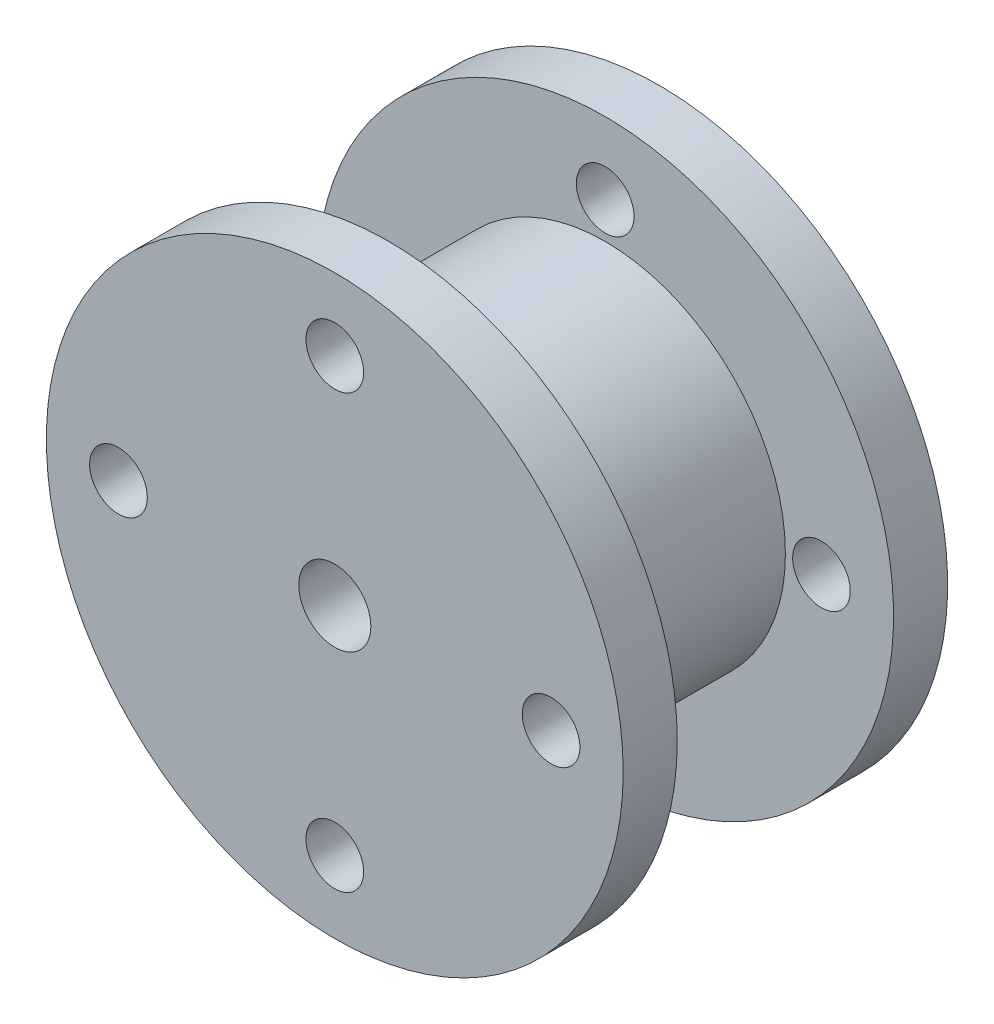
from build123d import *

# Parameters (mm, degrees)
SKETCH1_R               = 5
BOSS_EXTRUDE1_DEPTH     = 6
SKETCH2_R               = 8
BOSS_EXTRUDE2_DEPTH     = 1.5
BOSS_EXTRUDE3_START     = 1.5
SKETCH3_R               = 8
BOSS_EXTRUDE3_DEPTH     = 1.5
CUT_EXTRUDE1_DEPTH      = 15.456832295
CUT_EXTRUDE1_DEPTH_BACK = 15.456832295
SKETCH4_R               = 0.8
CUT_EXTRUDE2_DEPTH      = 15.456832295
CUT_EXTRUDE2_DEPTH_BACK = 15.456832295
SKETCH5_R               = 1


with BuildPart() as part:
    # Sketch1 → Boss-Extrude1 (new body)
    with BuildSketch(Plane.XY):
        Circle(SKETCH1_R)
    extrude(amount=BOSS_EXTRUDE1_DEPTH)

    # Sketch2 → Boss-Extrude2 (add)
    with BuildSketch(Plane.XY.offset(6)):
        Circle(SKETCH2_R)
    extrude(amount=BOSS_EXTRUDE2_DEPTH)

    # Sketch3 → Boss-Extrude3 (add)
    with BuildSketch(Plane(origin=(0, 0, 0), x_dir=(-1, 0, 0), z_dir=(0, 0, -1)).offset(BOSS_EXTRUDE3_START)):
        Circle(SKETCH3_R)
    extrude(amount=-BOSS_EXTRUDE3_DEPTH)

    # Sketch4 → Cut-Extrude1 (cut, two sides: drawn at the far end of the back side and taken through both)
    with BuildSketch(Plane.XY.offset(7.5).offset(-CUT_EXTRUDE1_DEPTH_BACK)):
        with Locations((-6, 0)):
            Circle(SKETCH4_R)
        with Locations((6, 0)):
            Circle(SKETCH4_R)
        with Locations((0, 6)):
            Circle(SKETCH4_R)
        with Locations((0, -6)):
            Circle(SKETCH4_R)
    extrude(amount=CUT_EXTRUDE1_DEPTH + CUT_EXTRUDE1_DEPTH_BACK, mode=Mode.SUBTRACT)

    # Sketch5 → Cut-Extrude2 (cut, two sides: drawn at the far end of the back side and taken through both)
    with BuildSketch(Plane.XY.offset(7.5).offset(-CUT_EXTRUDE2_DEPTH_BACK)):
        Circle(SKETCH5_R)
    extrude(amount=CUT_EXTRUDE2_DEPTH + CUT_EXTRUDE2_DEPTH_BACK, mode=Mode.SUBTRACT)


solid = part.part
